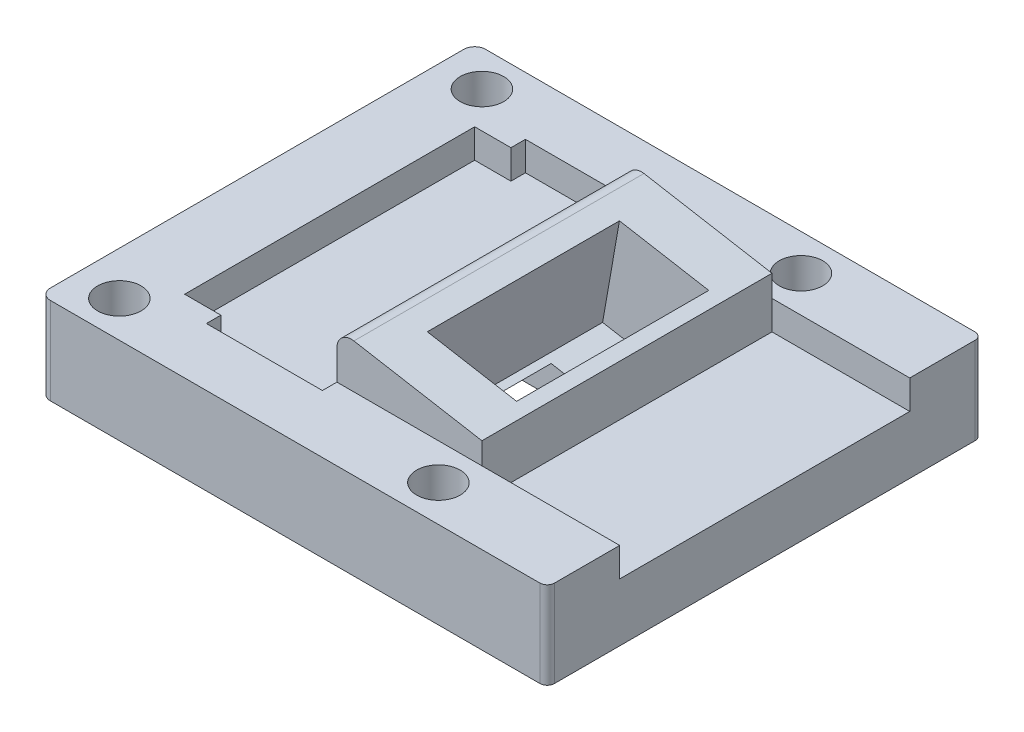
from build123d import *

# Parameters (mm, degrees)
SKETCH1_W                = 30
SKETCH1_H                = 20
BASE_PLATE_DEPTH         = 1
SIDE_WALLS_DEPTH         = 6
SKETCH3_W                = 10
SKETCH3_H                = 20
SWITCH_BLOCK_DEPTH       = 6.5
SKETCH11_W               = 10.5
SKETCH11_H               = 20
SKETCH11_W_2             = 9.5
THICKER_BODY_DEPTH       = 3
SWITCH_BLOCK_ANGLE_DEPTH = 20
SKETCH4_R                = 1.5
M2_SCREWS_DEPTH          = 6
FILLET1_R                = 1
FILLET2_R                = 0.5
FILLET3_R                = 0.5
FILLET4_R                = 0.75
FILLET5_R                = 0.75
SKETCH19_W               = 8
SKETCH19_H               = 22
SPACE_FOR_LEAVER_DEPTH   = 2
SKETCH22_W               = 6.25
SKETCH22_H               = 13.25
SWITCH_DEPTH             = 6.75
SKETCH23_W               = 2.75
SKETCH23_H               = 13.25
CUT_EXTRUDE2_DEPTH       = 27.310171552
SKETCH24_W               = 20
SKETCH24_H               = 5
CUT_EXTRUDE3_DEPTH       = 2


with BuildPart() as part:
    # Sketch1 → Base Plate (new body)
    with BuildSketch(Plane(origin=(0, 0, 0), x_dir=(1, 0, 0), z_dir=(0, 1, 0))):
        Rectangle(SKETCH1_W, SKETCH1_H)
    extrude(amount=BASE_PLATE_DEPTH)

    # Sketch2 → Side Walls (add)
    with BuildSketch(Plane.XZ):
        Polygon((15, 10), (-15, 10), (-15, -10), (15, -10), (15, -15), (-20, -15), (-20, 15), (15, 15), align=None)
    extrude(amount=-SIDE_WALLS_DEPTH)

    # Sketch3 → Switch Block (add)
    with BuildSketch(Plane(origin=(0, 1, 0), x_dir=(1, 0, 0), z_dir=(0, 1, 0))):
        with Locations((0.5, 0)):
            Rectangle(SKETCH3_W, SKETCH3_H)
    extrude(amount=SWITCH_BLOCK_DEPTH)

    # Sketch11 → Thicker Body (add)
    with BuildSketch(Plane(origin=(0, 1, 0), x_dir=(1, 0, 0), z_dir=(0, 1, 0))):
        with Locations((-9.75, 0)):
            Rectangle(SKETCH11_W, SKETCH11_H)
        with Locations((10.25, 0)):
            Rectangle(SKETCH11_W_2, SKETCH11_H)
    extrude(amount=THICKER_BODY_DEPTH)

    # Sketch5 → Switch Block Angle (add)
    with BuildSketch(Plane(origin=(0, 0, -10), x_dir=(-1, 0, 0), z_dir=(0, 0, -1))):
        Polygon((4.5, 7.5), (4.5, 9.25), (-5.5, 7.5), align=None)
    extrude(amount=-SWITCH_BLOCK_ANGLE_DEPTH)

    # Sketch4 → M2 Screws (cut)
    with BuildSketch(Plane(origin=(0, 6, 0), x_dir=(1, 0, 0), z_dir=(0, 1, 0))):
        with Locations(Location((-17, -12.5, 0), (0, 0, 270))):
            Circle(SKETCH4_R)
        with Locations(Location((5, -12.5, 0), (0, 0, 270))):
            Circle(SKETCH4_R)
        with Locations(Location((5, 12.5, 0), (0, 0, 270))):
            Circle(SKETCH4_R)
        with Locations(Location((-17, 12.5, 0), (0, 0, 270))):
            Circle(SKETCH4_R)
    extrude(amount=-M2_SCREWS_DEPTH, mode=Mode.SUBTRACT)

    # Fillet1
    fillet1_edges = [part.edges().sort_by_distance(p)[0] for p in [
        (-4.5, 9.25, 0),
    ]]
    fillet(fillet1_edges, radius=FILLET1_R)

    # Fillet2
    fillet2_edges = [part.edges().sort_by_distance(p)[0] for p in [
        (15, 3, 15),
    ]]
    fillet(fillet2_edges, radius=FILLET2_R)

    # Fillet3
    fillet3_edges = [part.edges().sort_by_distance(p)[0] for p in [
        (15, 3, -15),
    ]]
    fillet(fillet3_edges, radius=FILLET3_R)

    # Fillet4
    fillet4_edges = [part.edges().sort_by_distance(p)[0] for p in [
        (-20, 3, -15),
    ]]
    fillet(fillet4_edges, radius=FILLET4_R)

    # Fillet5
    fillet5_edges = [part.edges().sort_by_distance(p)[0] for p in [
        (-20, 3, 15),
    ]]
    fillet(fillet5_edges, radius=FILLET5_R)

    # Sketch19 → Space for LEaver (cut)
    with BuildSketch(Plane(origin=(0, 6, 0), x_dir=(1, 0, 0), z_dir=(0, 1, 0))):
        with Locations((-8.5, 0)):
            Rectangle(SKETCH19_W, SKETCH19_H)
    extrude(amount=-SPACE_FOR_LEAVER_DEPTH, mode=Mode.SUBTRACT)

    # Sketch22 → Switch (cut)
    with BuildSketch(Plane(origin=(1.436931474, 8.211036992, 0), x_dir=(0.9850304671557042, -0.1723803317522482, 0), z_dir=(0.1723803317522482, 0.9850304671557042, 0))):
        Rectangle(SKETCH22_W, SKETCH22_H)
    extrude(amount=-SWITCH_DEPTH, mode=Mode.SUBTRACT)

    # Sketch23 → Cut-Extrude2 (cut, through all)
    with BuildSketch(Plane(origin=(0.273364234, 1.562081339, 0), x_dir=(0.9850304671557042, -0.1723803317522482, 0), z_dir=(0.1723803317522482, 0.9850304671557042, 0))):
        Rectangle(SKETCH23_W, SKETCH23_H)
    extrude(amount=-CUT_EXTRUDE2_DEPTH, mode=Mode.SUBTRACT)

    # Sketch24 → Cut-Extrude3 (cut)
    with BuildSketch(Plane.XZ):
        with Locations((-10, 0)):
            Rectangle(SKETCH24_W, SKETCH24_H)
    extrude(amount=-CUT_EXTRUDE3_DEPTH, mode=Mode.SUBTRACT)


solid = part.part
